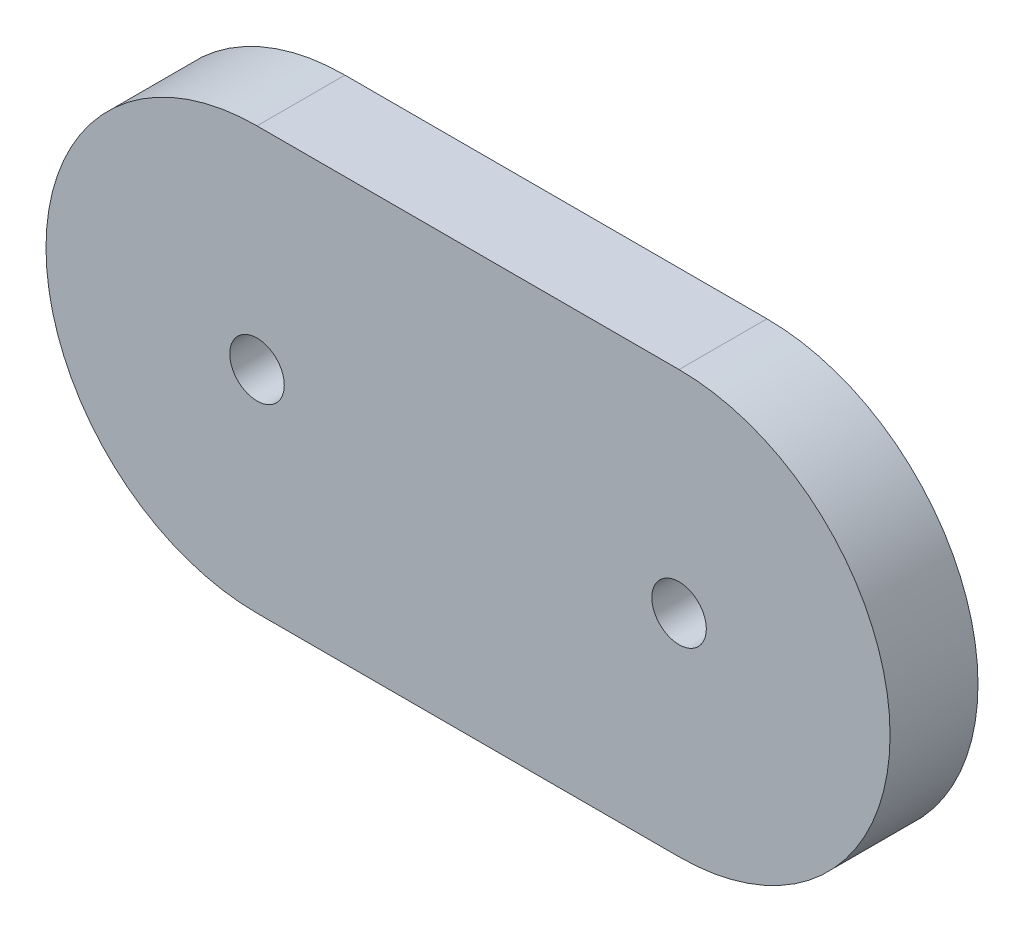
from build123d import *

# Parameters (mm, degrees)
EXTRUDE_1_DEPTH     = 5
SKETCH_2_R          = 1.55
CUT_EXTRUDE_1_DEPTH = 12


with BuildPart() as part:
    # 草图1 → 凸台-拉伸1 (new body)
    with BuildSketch(Plane.XY):
        with BuildLine():
            Line((0, 12), (24, 12))
            ThreePointArc((24, 12), (36, 0), (24, -12))
            Line((24, -12), (0, -12))
            ThreePointArc((0, -12), (-12, 0), (0, 12))
        make_face()
    extrude(amount=EXTRUDE_1_DEPTH)

    # 草图2 → 切除-拉伸1 (cut)
    with BuildSketch(Plane(origin=(0, 0, 0), x_dir=(-1, 0, 0), z_dir=(0, 0, -1))):
        Circle(SKETCH_2_R)
        with Locations((-24, 0)):
            Circle(SKETCH_2_R)
    extrude(amount=-CUT_EXTRUDE_1_DEPTH, mode=Mode.SUBTRACT)


solid = part.part
